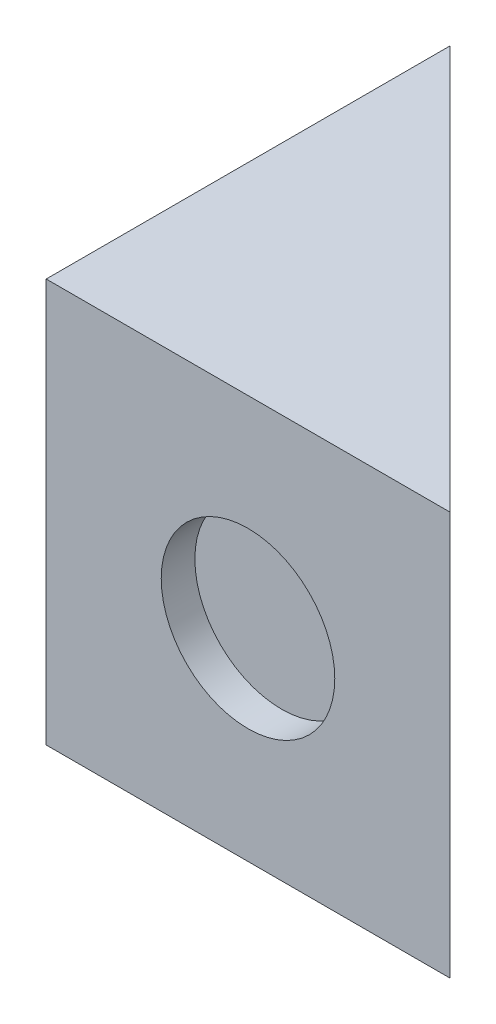
from build123d import *

# Parameters (mm, degrees)
BOSS_EXTRUDE1_DEPTH = 38.1
SKETCH2_R           = 8.1915
CUT_EXTRUDE1_DEPTH  = 3.175
SKETCH3_R           = 8.1915
CUT_EXTRUDE2_DEPTH  = 3.175
SKETCH4_R           = 4.8895
CUT_EXTRUDE3_DEPTH  = 1.6129


with BuildPart() as part:
    # Sketch1 → Boss-Extrude1 (new body)
    with BuildSketch(Plane(origin=(0, 0, 0), x_dir=(1, 0, 0), z_dir=(0, 1, 0))):
        Polygon((0, 0), (0, 38.1), (38.1, 0), align=None)
    extrude(amount=BOSS_EXTRUDE1_DEPTH)

    # Sketch2 → Cut-Extrude1 (cut)
    with BuildSketch(Plane.XY):
        with Locations((19.05, 19.05)):
            Circle(SKETCH2_R)
    extrude(amount=-CUT_EXTRUDE1_DEPTH, mode=Mode.SUBTRACT)

    # Sketch3 → Cut-Extrude2 (cut)
    with BuildSketch(Plane.ZY):
        with Locations((-25.4, 19.05)):
            Circle(SKETCH3_R)
    extrude(amount=-CUT_EXTRUDE2_DEPTH, mode=Mode.SUBTRACT)

    # Sketch4 → Cut-Extrude3 (cut)
    with BuildSketch(Plane.ZY):
        with Locations((-7.62, 19.05)):
            Circle(SKETCH4_R)
    extrude(amount=-CUT_EXTRUDE3_DEPTH, mode=Mode.SUBTRACT)


solid = part.part
